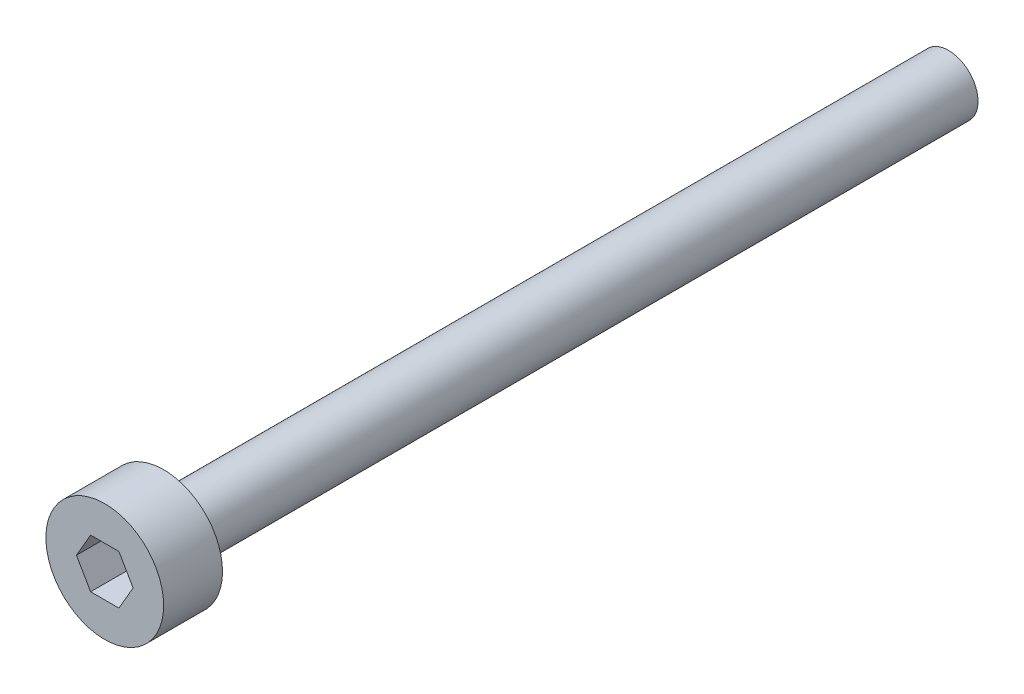
from build123d import *

# Parameters (mm, degrees)
SKETCH_5_R          = 3
EXTRUDE_1_DEPTH     = 3
CUT_EXTRUDE_1_DEPTH = 2
SKETCH_7_R          = 1.5
EXTRUDE_2_DEPTH     = 40


with BuildPart() as part:
    # ｽｹｯﾁ5 → ﾎﾞｽ - 押し出し1 (new body)
    with BuildSketch(Plane.XY):
        Circle(SKETCH_5_R)
    extrude(amount=EXTRUDE_1_DEPTH)

    # ｽｹｯﾁ6 → ｶｯﾄ - 押し出し1 (cut)
    with BuildSketch(Plane.XY.offset(3)):
        Polygon((1.443375673, 0), (0.721687836, 1.25), (-0.721687836, 1.25), (-1.443375673, 0), (-0.721687836, -1.25), (0.721687836, -1.25), align=None)
    extrude(amount=-CUT_EXTRUDE_1_DEPTH, mode=Mode.SUBTRACT)

    # ｽｹｯﾁ7 → ﾎﾞｽ - 押し出し2 (add)
    with BuildSketch(Plane(origin=(0, 0, 0), x_dir=(-1, 0, 0), z_dir=(0, 0, -1))):
        Circle(SKETCH_7_R)
    extrude(amount=EXTRUDE_2_DEPTH)


solid = part.part
